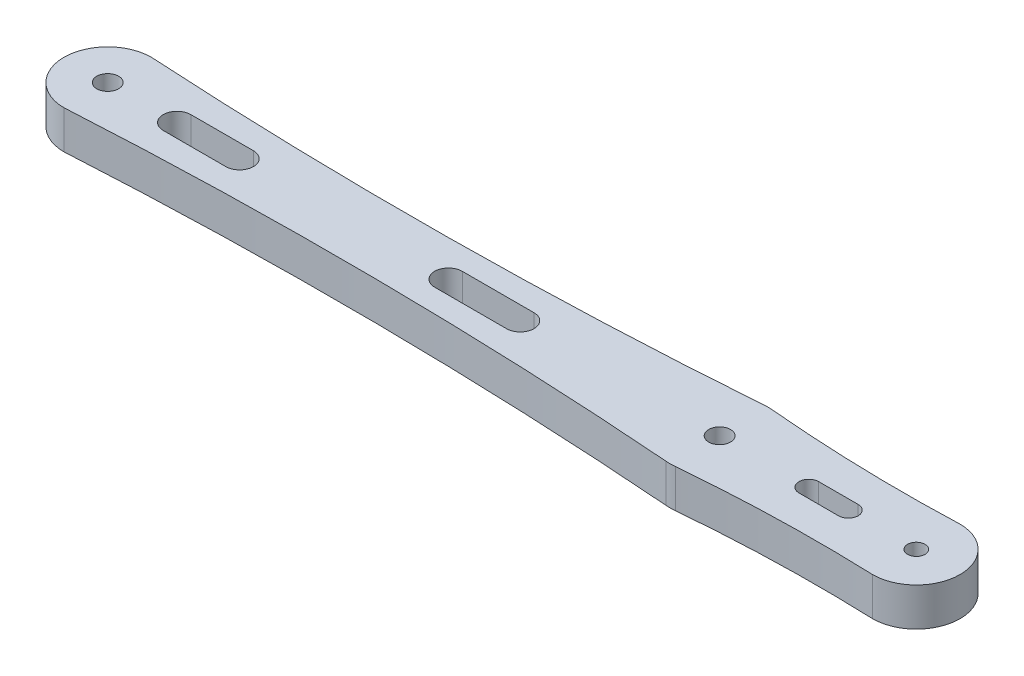
from build123d import *

# Parameters (mm, degrees)
SKETCH1_R           = 2
SKETCH1_R_2         = 1.6
BOSS_EXTRUDE1_DEPTH = 7
FILLET1_R           = 10
CUT_EXTRUDE1_DEPTH  = 7


with BuildPart() as part:
    # Sketch1 → Boss-Extrude1 (new body)
    with BuildSketch(Plane(origin=(0, 0, 0), x_dir=(1, 0, 0), z_dir=(0, 1, 0))):
        with BuildLine():
            ThreePointArc((-112, -8), (-55.983036626, -6.600102157), (0, -9))
            ThreePointArc((0, -9), (17.983664082, -7.911906937), (36, -8))
            ThreePointArc((36, -8), (44, 0), (36, 8))
            ThreePointArc((36, 8), (17.983664082, 7.911906937), (0, 9))
            ThreePointArc((0, 9), (-55.983036626, 6.600102157), (-112, 8))
            ThreePointArc((-112, 8), (-120, 0), (-112, -8))
        make_face()
        with Locations(Location((-112, 0, 0), (0, 0, 270))):
            Circle(SKETCH1_R, mode=Mode.SUBTRACT)
        with Locations(Location((0, 0, 0), (0, 0, 270))):
            Circle(SKETCH1_R, mode=Mode.SUBTRACT)
        with Locations(Location((36, 0, 0), (0, 0, 270))):
            Circle(SKETCH1_R_2, mode=Mode.SUBTRACT)
    extrude(amount=BOSS_EXTRUDE1_DEPTH)

    # Fillet1
    fillet1_edges = [part.edges().sort_by_distance(p)[0] for p in [
        (0, 3.5, 9),
        (0, 3.5, -9),
    ]]
    fillet(fillet1_edges, radius=FILLET1_R)

    # Sketch2 → Cut-Extrude1 (cut)
    with BuildSketch(Plane(origin=(0, 7, 0), x_dir=(1, 0, 0), z_dir=(0, 1, 0))):
        with BuildLine():
            Line((-99.309344494, 2.524246591), (-87.854034524, 2.524246591))
            ThreePointArc((-87.854034524, 2.524246591), (-85.329787933, 0), (-87.854034524, -2.524246591))
            Line((-87.854034524, -2.524246591), (-99.309344494, -2.524246591))
            ThreePointArc((-99.309344494, -2.524246591), (-101.833591085, 0), (-99.309344494, 2.524246591))
        make_face()
        with BuildLine():
            Line((-49.629473884, 2.524246591), (-36.48601297, 2.524246591))
            ThreePointArc((-36.48601297, 2.524246591), (-33.96176638, 0), (-36.48601297, -2.524246591))
            Line((-36.48601297, -2.524246591), (-49.629473884, -2.524246591))
            ThreePointArc((-49.629473884, -2.524246591), (-52.153720475, 0), (-49.629473884, 2.524246591))
        make_face()
        with BuildLine():
            Line((16.328995105, 1.800753329), (23.563927718, 1.800753329))
            ThreePointArc((23.563927718, 1.800753329), (25.364681048, 0), (23.563927718, -1.800753329))
            Line((23.563927718, -1.800753329), (16.328995105, -1.800753329))
            ThreePointArc((16.328995105, -1.800753329), (14.528241776, 0), (16.328995105, 1.800753329))
        make_face()
    extrude(amount=-CUT_EXTRUDE1_DEPTH, mode=Mode.SUBTRACT)


solid = part.part
